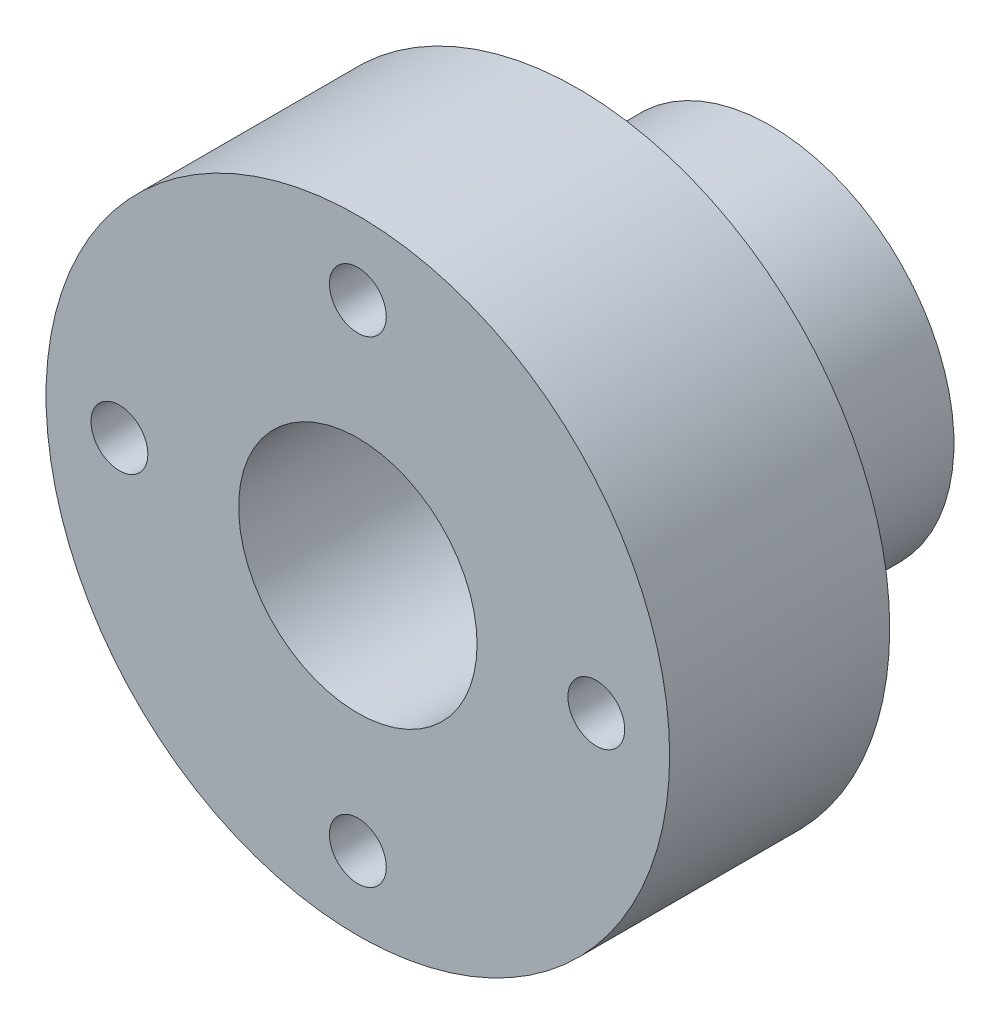
from build123d import *

# Parameters (mm, degrees)
SKETCH1_R           = 10
BOSS_EXTRUDE1_DEPTH = 10.5
SKETCH3_R           = 17
BOSS_EXTRUDE2_DEPTH = 12
SKETCH4_R           = 1.55
CUT_EXTRUDE3_DEPTH  = 33.927951652
SKETCH5_R           = 1.55
CUT_EXTRUDE5_DEPTH  = 33.927951652
SKETCH6_R           = 1.75
CUT_EXTRUDE6_DEPTH  = 5.2
SKETCH7_R           = 1.75
CUT_EXTRUDE7_DEPTH  = 18.5
SKETCH8_R           = 6.5
CUT_EXTRUDE8_DEPTH  = 13.5


with BuildPart() as part:
    # Sketch1 → Boss-Extrude1 (new body)
    with BuildSketch(Plane.XY):
        with Locations(Location((0, 0, 0), (0, 0, 180))):
            Circle(SKETCH1_R)
    extrude(amount=BOSS_EXTRUDE1_DEPTH)

    # Sketch3 → Boss-Extrude2 (add)
    with BuildSketch(Plane.XY.offset(10.5)):
        Circle(SKETCH3_R)
    extrude(amount=BOSS_EXTRUDE2_DEPTH)

    # Sketch4 → Cut-Extrude3 (cut, through all)
    with BuildSketch(Plane.XY.offset(22.5)):
        with Locations((3, 0)):
            Circle(SKETCH4_R)
        with Locations((-3, 0)):
            Circle(SKETCH4_R)
    extrude(amount=-CUT_EXTRUDE3_DEPTH, mode=Mode.SUBTRACT)

    # Sketch5 → Cut-Extrude5 (cut, through all)
    with BuildSketch(Plane.XY.offset(22.5)):
        with Locations((13, 0)):
            Circle(SKETCH5_R)
        with Locations((0, -13)):
            Circle(SKETCH5_R)
        with Locations((-13, 0)):
            Circle(SKETCH5_R)
        with Locations((0, 13)):
            Circle(SKETCH5_R)
    extrude(amount=-CUT_EXTRUDE5_DEPTH, mode=Mode.SUBTRACT)

    # Sketch6 → Cut-Extrude6 (cut)
    with BuildSketch(Plane(origin=(0, 0, 10.5), x_dir=(-1, 0, 0), z_dir=(0, 0, -1))):
        with Locations((13, 0)):
            Circle(SKETCH6_R)
        with Locations((0, -13)):
            Circle(SKETCH6_R)
        with Locations((-13, 0)):
            Circle(SKETCH6_R)
        with Locations((0, 13)):
            Circle(SKETCH6_R)
    extrude(amount=-CUT_EXTRUDE6_DEPTH, mode=Mode.SUBTRACT)

    # Sketch7 → Cut-Extrude7 (cut)
    with BuildSketch(Plane.XY.offset(22.5)):
        with Locations((3, 0)):
            Circle(SKETCH7_R)
        with Locations((-3, 0)):
            Circle(SKETCH7_R)
    extrude(amount=-CUT_EXTRUDE7_DEPTH, mode=Mode.SUBTRACT)

    # Sketch8 → Cut-Extrude8 (cut)
    with BuildSketch(Plane.XY.offset(22.5)):
        Circle(SKETCH8_R)
    extrude(amount=-CUT_EXTRUDE8_DEPTH, mode=Mode.SUBTRACT)


solid = part.part
